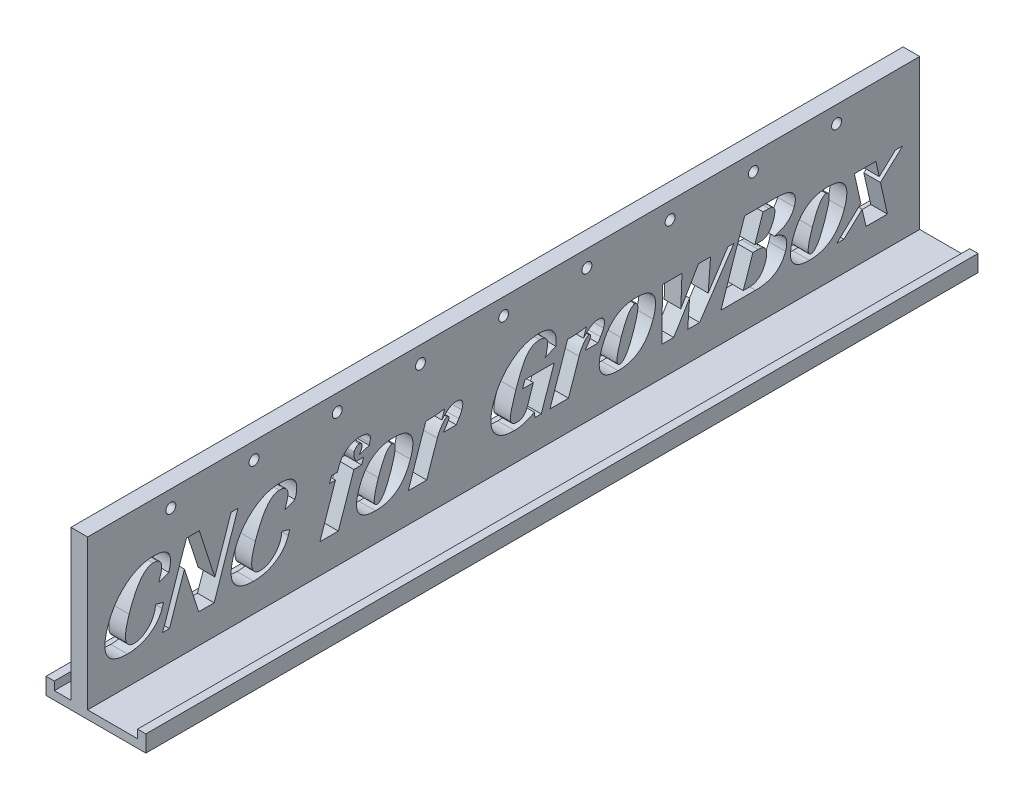
from build123d import *

# Parameters (mm, degrees)
BOSS_EXTRUDE1_DEPTH = 500
SKETCH4_R           = 3
CUT_EXTRUDE3_DEPTH  = 10
LPATTERN2_COUNT     = 9
LPATTERN2_PITCH     = 50
CUT_EXTRUDE4_DEPTH  = 10


with BuildPart() as part:
    # Sketch1 → Boss-Extrude1 (new body)
    with BuildSketch(Plane.XY):
        Polygon((0, 10), (0, 0), (60, 0), (60, 10), (55, 10), (55, 5), (25, 5), (25, 95), (15, 95), (15, 5), (5, 5), (5, 10), align=None)
    extrude(amount=BOSS_EXTRUDE1_DEPTH)

    # Sketch4 → Cut-Extrude3 (cut)
    with BuildSketch(Plane(origin=(25, 0, 0), x_dir=(0, 0, -1), z_dir=(1, 0, 0))):
        with Locations((-450, 85)):
            Circle(SKETCH4_R)
    cut_extrude3 = extrude(amount=-CUT_EXTRUDE3_DEPTH, mode=Mode.SUBTRACT)

    # LPattern2: Cut-Extrude3 ×9
    with Locations(*[(0, 0, -i * LPATTERN2_PITCH) for i in range(1, LPATTERN2_COUNT)]):
        add(cut_extrude3, mode=Mode.SUBTRACT)

    # Sketch5 → Cut-Extrude4 (cut)
    # profile 1 of 13: a face of its own
    with BuildSketch(Plane(origin=(25, 0, 0), x_dir=(0, 0, -1), z_dir=(1, 0, 0))):
        with BuildLine():
            Line((-459.161110895, 39.51730532), (-454.421527562, 38.159232404))
            add(Edge.make_bspline(
                [(-454.421527562, 38.159232404), (-454.557358156, 37.665866309), (-454.810785543, 36.745363235), (-455.105216544, 35.837168443), (-455.241840062, 35.41574282)],
                knots=[0, 0, 0, 0, 1.071948824, 2, 2, 2, 2], degree=3))
            add(Edge.make_bspline(
                [(-455.241840062, 35.41574282), (-455.42420157, 34.919729406), (-455.785331039, 33.93747683), (-456.483717378, 32.537469266), (-457.26685806, 31.201074568), (-458.194099839, 29.958302794), (-459.210962327, 28.775209094), (-460.359418633, 27.682164967), (-461.612016317, 26.658933351), (-462.963455446, 25.715054219), (-464.402513774, 24.869424028), (-465.904311837, 24.1313331), (-467.464954886, 23.508611183), (-469.078717264, 22.996548219), (-470.752653154, 22.606694765), (-472.479164194, 22.326209691), (-474.260127081, 22.145492745), (-475.466660783, 22.126955145), (-476.077777562, 22.117565737)],
                knots=[0, 0, 0, 0, 0.959608273, 1.900306866, 2.838588561, 3.770530829, 4.713672441, 5.67029048, 6.647211372, 7.650361338, 8.662524894, 9.677289817, 10.688112489, 11.713023596, 12.75083405, 13.808195716, 14.88983758, 16, 16, 16, 16], degree=3))
            add(Edge.make_bspline(
                [(-476.077777562, 22.117565737), (-476.822843901, 22.131935055), (-478.25056488, 22.159470021), (-480.293023972, 22.40466536), (-482.135299547, 22.810906875), (-483.78698429, 23.367542536), (-485.235288516, 24.109717295), (-486.481859838, 25.016805255), (-487.527859758, 26.092050507), (-488.350216837, 27.343304949), (-488.990113947, 28.746021332), (-489.402122483, 30.317762367), (-489.61509731, 32.045631602), (-489.624342171, 33.934374484), (-489.43278083, 35.983460499), (-489.043410082, 38.195320243), (-488.443738018, 40.567464255), (-487.923906627, 42.18459262), (-487.653298395, 43.026419904)],
                knots=[0, 0, 0, 0, 1.188371361, 2.277196852, 3.275607737, 4.193834061, 5.050162067, 5.861634596, 6.643226294, 7.429687769, 8.238826122, 9.092488531, 10.011162535, 11.009738138, 12.099836037, 13.290399986, 14.58946558, 16, 16, 16, 16], degree=3))
            add(Edge.make_bspline(
                [(-487.653298395, 43.026419904), (-487.360773926, 43.839091562), (-486.783537623, 45.442730342), (-485.730366705, 47.745947975), (-484.5696536, 49.941612959), (-483.259456087, 52.00971765), (-481.835399629, 53.975902299), (-480.26692908, 55.811468748), (-478.571379983, 57.536525696), (-476.760197845, 59.127172484), (-474.871136638, 60.573415012), (-472.919019684, 61.824214914), (-470.939385114, 62.903629651), (-468.910046915, 63.767015891), (-466.8471071, 64.450019633), (-464.748264638, 64.933155623), (-462.608449529, 65.222899541), (-461.17023672, 65.26369615), (-460.446267145, 65.284232404)],
                knots=[0, 0, 0, 0, 1.10590169, 2.182267365, 3.240784825, 4.284853365, 5.315446473, 6.347918835, 7.374366952, 8.411142825, 9.433103175, 10.418671707, 11.378077474, 12.317794117, 13.239546828, 14.158073567, 15.072808497, 16, 16, 16, 16], degree=3))
            add(Edge.make_bspline(
                [(-460.446267145, 65.284232404), (-459.902204346, 65.272490358), (-458.857585084, 65.249945228), (-457.355450336, 65.114033425), (-455.999393291, 64.847761749), (-454.776483312, 64.497325518), (-453.700421866, 64.036050113), (-452.758385154, 63.473137675), (-451.953186777, 62.806304391), (-451.3018065, 62.0212929), (-450.786120222, 61.139288103), (-450.439276259, 60.147930309), (-450.202630012, 59.064434663), (-450.147631926, 57.874140371), (-450.195842913, 56.584617813), (-450.421476631, 55.195884038), (-450.766255253, 53.705828634), (-451.09010804, 52.694852608), (-451.258767145, 52.168346987)],
                knots=[0, 0, 0, 0, 1.289754129, 2.476372226, 3.569498017, 4.56068904, 5.486411475, 6.336102184, 7.153947633, 7.951504273, 8.742007375, 9.56213236, 10.430745964, 11.3614965, 12.377796713, 13.484852439, 14.690137755, 16, 16, 16, 16], degree=3))
            Line((-451.258767145, 52.168346987), (-457.301735895, 49.780326154))
            add(Edge.make_bspline(
                [(-457.301735895, 49.780326154), (-457.214545183, 50.066205058), (-457.049150435, 50.608497556), (-456.803748985, 51.363318087), (-456.592096396, 52.019897661), (-456.460324577, 52.420571794), (-456.399392145, 52.605846987)],
                knots=[0, 0, 0, 0, 1.209122552, 2.293621811, 3.210955934, 4, 4, 4, 4], degree=3))
            add(Edge.make_bspline(
                [(-456.399392145, 52.605846987), (-456.280924626, 52.975564138), (-456.053167792, 53.68635481), (-455.773531946, 54.724294312), (-455.590111047, 55.696453897), (-455.485282334, 56.59543531), (-455.468113498, 57.424993803), (-455.511700903, 58.181917938), (-455.660416846, 58.869127392), (-455.888518839, 59.482373262), (-456.188435206, 60.035327969), (-456.591971537, 60.504139766), (-457.065758258, 60.909704826), (-457.630610425, 61.231270692), (-458.270104769, 61.489153615), (-458.996814914, 61.651775794), (-459.798480202, 61.767441206), (-460.360710968, 61.778451565), (-460.655902562, 61.784232404)],
                knots=[0, 0, 0, 0, 1.473995899, 2.833794789, 4.078113512, 5.227138281, 6.265573707, 7.225503937, 8.098842969, 8.923759755, 9.703568102, 10.473070159, 11.258828084, 12.060097264, 12.92977192, 13.867048012, 14.880122655, 16, 16, 16, 16], degree=3))
            add(Edge.make_bspline(
                [(-460.655902562, 61.784232404), (-460.979208186, 61.770409686), (-461.633747642, 61.742425285), (-462.605901063, 61.503781059), (-463.562514623, 61.11290844), (-464.510016263, 60.574685918), (-465.450229257, 59.888528421), (-466.368980947, 59.038944471), (-467.28461753, 58.049568897), (-468.183750945, 56.900872774), (-469.087694809, 55.608468111), (-469.965382156, 54.153488815), (-470.840426718, 52.556713766), (-471.706542955, 50.806807837), (-472.570362045, 48.908376059), (-473.415546481, 46.851066055), (-474.254011803, 44.647410054), (-474.784425544, 43.118990688), (-475.056944228, 42.33371157)],
                knots=[0, 0, 0, 0, 0.608730714, 1.232388927, 1.874671758, 2.551581591, 3.281205007, 4.063553032, 4.906412784, 5.819526811, 6.810799485, 7.877366486, 9.020379324, 10.241954853, 11.55662264, 12.950800273, 14.433366571, 16, 16, 16, 16], degree=3))
            add(Edge.make_bspline(
                [(-475.056944228, 42.33371157), (-475.280985814, 41.660896302), (-475.712578722, 40.364787378), (-476.249726593, 38.47000022), (-476.672842051, 36.706287931), (-476.986078883, 35.07334493), (-477.193723319, 33.567736442), (-477.281302606, 32.190301951), (-477.249458186, 30.944945275), (-477.106511226, 29.829032534), (-476.860803539, 28.836845204), (-476.484423799, 27.972079924), (-475.989930464, 27.237929685), (-475.37051357, 26.644217917), (-474.650761636, 26.163464501), (-473.797013454, 25.854625256), (-472.843087523, 25.6460955), (-472.165851087, 25.627353876), (-471.812152562, 25.617565737)],
                knots=[0, 0, 0, 0, 1.681988387, 3.240176405, 4.670082134, 5.983193915, 7.182866418, 8.273049076, 9.253619859, 10.133253211, 10.93733841, 11.669829657, 12.359479887, 13.022050276, 13.693691261, 14.396360891, 15.162471542, 16, 16, 16, 16], degree=3))
            add(Edge.make_bspline(
                [(-471.812152562, 25.617565737), (-471.504926384, 25.62718288), (-470.8939335, 25.646308874), (-469.979317622, 25.774858819), (-469.078570581, 26.008277768), (-468.184244535, 26.316704392), (-467.300500764, 26.714557209), (-466.425117403, 27.198353849), (-465.557615245, 27.775934784), (-464.710027666, 28.436659136), (-463.895474878, 29.162553832), (-463.12684463, 29.93246323), (-462.433604488, 30.76127608), (-461.794689347, 31.624147618), (-461.219187412, 32.533443346), (-460.695452085, 33.478899396), (-460.249153682, 34.478817082), (-459.998557534, 35.168053918), (-459.872048395, 35.516003237)],
                knots=[0, 0, 0, 0, 0.894992687, 1.779907445, 2.683609881, 3.601673395, 4.532657576, 5.503187957, 6.512064498, 7.56541979, 8.631158139, 9.688817706, 10.731372136, 11.775765717, 12.81433043, 13.863960975, 14.921657571, 16, 16, 16, 16], degree=3))
            add(Edge.make_bspline(
                [(-459.872048395, 35.516003237), (-459.795078727, 35.767126343), (-459.626208883, 36.318085185), (-459.445809807, 37.243572602), (-459.282028524, 38.326139769), (-459.203101734, 39.103651484), (-459.161110895, 39.51730532)],
                knots=[0, 0, 0, 0, 0.77360874, 1.6972814, 2.77490157, 4, 4, 4, 4], degree=3))
        make_face()
    # profile 2 of 13: a face of its own
    with BuildSketch(Plane(origin=(25, 0, 0), x_dir=(0, 0, -1), z_dir=(1, 0, 0))):
        Polygon((-409.705381728, 64.70089907), (-423.978819228, 22.70089907), (-433.284808812, 22.70089907), (-441.806944228, 49.19699282), (-450.812152562, 22.70089907), (-454.895485895, 22.70089907), (-440.622048395, 64.70089907), (-432.911110895, 64.70089907), (-423.559548395, 35.953503237), (-413.788715062, 64.70089907), align=None)
    # profile 3 of 13: a face of its own
    with BuildSketch(Plane(origin=(25, 0, 0), x_dir=(0, 0, -1), z_dir=(1, 0, 0))):
        with BuildLine():
            Line((-383.327777562, 39.51730532), (-378.588194228, 38.159232404))
            add(Edge.make_bspline(
                [(-378.588194228, 38.159232404), (-378.724024823, 37.665866309), (-378.97745221, 36.745363235), (-379.27188321, 35.837168443), (-379.408506728, 35.41574282)],
                knots=[0, 0, 0, 0, 1.071948824, 2, 2, 2, 2], degree=3))
            add(Edge.make_bspline(
                [(-379.408506728, 35.41574282), (-379.590868237, 34.919729406), (-379.951997706, 33.93747683), (-380.650384045, 32.537469266), (-381.433524727, 31.201074568), (-382.360766505, 29.958302794), (-383.377628993, 28.775209094), (-384.5260853, 27.682164967), (-385.778682984, 26.658933351), (-387.130122113, 25.715054219), (-388.569180441, 24.869424028), (-390.070978504, 24.1313331), (-391.631621553, 23.508611183), (-393.245383931, 22.996548219), (-394.919319821, 22.606694765), (-396.645830861, 22.326209691), (-398.426793748, 22.145492745), (-399.633327449, 22.126955145), (-400.244444228, 22.117565737)],
                knots=[0, 0, 0, 0, 0.959608273, 1.900306866, 2.838588561, 3.770530829, 4.713672441, 5.67029048, 6.647211372, 7.650361338, 8.662524894, 9.677289817, 10.688112489, 11.713023596, 12.75083405, 13.808195716, 14.88983758, 16, 16, 16, 16], degree=3))
            add(Edge.make_bspline(
                [(-400.244444228, 22.117565737), (-400.989510568, 22.131935055), (-402.417231547, 22.159470021), (-404.459690638, 22.40466536), (-406.301966213, 22.810906875), (-407.953650957, 23.367542536), (-409.401955182, 24.109717295), (-410.648526505, 25.016805255), (-411.694526425, 26.092050507), (-412.516883504, 27.343304949), (-413.156780614, 28.746021332), (-413.56878915, 30.317762367), (-413.781763977, 32.045631602), (-413.791008838, 33.934374484), (-413.599447496, 35.983460499), (-413.210076749, 38.195320243), (-412.610404685, 40.567464255), (-412.090573294, 42.18459262), (-411.819965062, 43.026419904)],
                knots=[0, 0, 0, 0, 1.188371361, 2.277196852, 3.275607737, 4.193834061, 5.050162067, 5.861634596, 6.643226294, 7.429687769, 8.238826122, 9.092488531, 10.011162535, 11.009738138, 12.099836037, 13.290399986, 14.58946558, 16, 16, 16, 16], degree=3))
            add(Edge.make_bspline(
                [(-411.819965062, 43.026419904), (-411.527440592, 43.839091562), (-410.950204289, 45.442730342), (-409.897033372, 47.745947975), (-408.736320266, 49.941612959), (-407.426122753, 52.00971765), (-406.002066296, 53.975902299), (-404.433595747, 55.811468748), (-402.73804665, 57.536525696), (-400.926864511, 59.127172484), (-399.037803305, 60.573415012), (-397.08568635, 61.824214914), (-395.106051781, 62.903629651), (-393.076713582, 63.767015891), (-391.013773766, 64.450019633), (-388.914931305, 64.933155623), (-386.775116196, 65.222899541), (-385.336903387, 65.26369615), (-384.612933812, 65.284232404)],
                knots=[0, 0, 0, 0, 1.10590169, 2.182267365, 3.240784825, 4.284853365, 5.315446473, 6.347918835, 7.374366952, 8.411142825, 9.433103175, 10.418671707, 11.378077474, 12.317794117, 13.239546828, 14.158073567, 15.072808497, 16, 16, 16, 16], degree=3))
            add(Edge.make_bspline(
                [(-384.612933812, 65.284232404), (-384.068871012, 65.272490358), (-383.024251751, 65.249945228), (-381.522117003, 65.114033425), (-380.166059958, 64.847761749), (-378.943149979, 64.497325518), (-377.867088532, 64.036050113), (-376.925051821, 63.473137675), (-376.119853444, 62.806304391), (-375.468473167, 62.0212929), (-374.952786888, 61.139288103), (-374.605942925, 60.147930309), (-374.369296679, 59.064434663), (-374.314298593, 57.874140371), (-374.36250958, 56.584617813), (-374.588143297, 55.195884038), (-374.93292192, 53.705828634), (-375.256774706, 52.694852608), (-375.425433812, 52.168346987)],
                knots=[0, 0, 0, 0, 1.289754129, 2.476372226, 3.569498017, 4.56068904, 5.486411475, 6.336102184, 7.153947633, 7.951504273, 8.742007375, 9.56213236, 10.430745964, 11.3614965, 12.377796713, 13.484852439, 14.690137755, 16, 16, 16, 16], degree=3))
            Line((-375.425433812, 52.168346987), (-381.468402562, 49.780326154))
            add(Edge.make_bspline(
                [(-381.468402562, 49.780326154), (-381.381211849, 50.066205058), (-381.215817102, 50.608497556), (-380.970415652, 51.363318087), (-380.758763063, 52.019897661), (-380.626991243, 52.420571794), (-380.566058812, 52.605846987)],
                knots=[0, 0, 0, 0, 1.209122552, 2.293621811, 3.210955934, 4, 4, 4, 4], degree=3))
            add(Edge.make_bspline(
                [(-380.566058812, 52.605846987), (-380.447591292, 52.975564138), (-380.219834458, 53.68635481), (-379.940198612, 54.724294312), (-379.756777713, 55.696453897), (-379.651949, 56.59543531), (-379.634780164, 57.424993803), (-379.678367569, 58.181917938), (-379.827083512, 58.869127392), (-380.055185505, 59.482373262), (-380.355101872, 60.035327969), (-380.758638204, 60.504139766), (-381.232424925, 60.909704826), (-381.797277092, 61.231270692), (-382.436771435, 61.489153615), (-383.163481581, 61.651775794), (-383.965146869, 61.767441206), (-384.527377635, 61.778451565), (-384.822569228, 61.784232404)],
                knots=[0, 0, 0, 0, 1.473995899, 2.833794789, 4.078113512, 5.227138281, 6.265573707, 7.225503937, 8.098842969, 8.923759755, 9.703568102, 10.473070159, 11.258828084, 12.060097264, 12.92977192, 13.867048012, 14.880122655, 16, 16, 16, 16], degree=3))
            add(Edge.make_bspline(
                [(-384.822569228, 61.784232404), (-385.145874852, 61.770409686), (-385.800414309, 61.742425285), (-386.77256773, 61.503781059), (-387.72918129, 61.11290844), (-388.67668293, 60.574685918), (-389.616895924, 59.888528421), (-390.535647614, 59.038944471), (-391.451284197, 58.049568897), (-392.350417612, 56.900872774), (-393.254361476, 55.608468111), (-394.132048822, 54.153488815), (-395.007093385, 52.556713766), (-395.873209622, 50.806807837), (-396.737028712, 48.908376059), (-397.582213147, 46.851066055), (-398.42067847, 44.647410054), (-398.951092211, 43.118990688), (-399.223610895, 42.33371157)],
                knots=[0, 0, 0, 0, 0.608730714, 1.232388927, 1.874671758, 2.551581591, 3.281205007, 4.063553032, 4.906412784, 5.819526811, 6.810799485, 7.877366486, 9.020379324, 10.241954853, 11.55662264, 12.950800273, 14.433366571, 16, 16, 16, 16], degree=3))
            add(Edge.make_bspline(
                [(-399.223610895, 42.33371157), (-399.447652481, 41.660896302), (-399.879245388, 40.364787378), (-400.416393259, 38.47000022), (-400.839508717, 36.706287931), (-401.15274555, 35.07334493), (-401.360389986, 33.567736442), (-401.447969273, 32.190301951), (-401.416124852, 30.944945275), (-401.273177892, 29.829032534), (-401.027470205, 28.836845204), (-400.651090466, 27.972079924), (-400.15659713, 27.237929685), (-399.537180237, 26.644217917), (-398.817428302, 26.163464501), (-397.963680121, 25.854625256), (-397.009754189, 25.6460955), (-396.332517754, 25.627353876), (-395.978819228, 25.617565737)],
                knots=[0, 0, 0, 0, 1.681988387, 3.240176405, 4.670082134, 5.983193915, 7.182866418, 8.273049076, 9.253619859, 10.133253211, 10.93733841, 11.669829657, 12.359479887, 13.022050276, 13.693691261, 14.396360891, 15.162471542, 16, 16, 16, 16], degree=3))
            add(Edge.make_bspline(
                [(-395.978819228, 25.617565737), (-395.67159305, 25.62718288), (-395.060600167, 25.646308874), (-394.145984289, 25.774858819), (-393.245237248, 26.008277768), (-392.350911202, 26.316704392), (-391.46716743, 26.714557209), (-390.591784069, 27.198353849), (-389.724281912, 27.775934784), (-388.876694333, 28.436659136), (-388.062141544, 29.162553832), (-387.293511296, 29.93246323), (-386.600271154, 30.76127608), (-385.961356013, 31.624147618), (-385.385854079, 32.533443346), (-384.862118752, 33.478899396), (-384.415820348, 34.478817082), (-384.165224201, 35.168053918), (-384.038715062, 35.516003237)],
                knots=[0, 0, 0, 0, 0.894992687, 1.779907445, 2.683609881, 3.601673395, 4.532657576, 5.503187957, 6.512064498, 7.56541979, 8.631158139, 9.688817706, 10.731372136, 11.775765717, 12.81433043, 13.863960975, 14.921657571, 16, 16, 16, 16], degree=3))
            add(Edge.make_bspline(
                [(-384.038715062, 35.516003237), (-383.961745393, 35.767126343), (-383.79287555, 36.318085185), (-383.612476473, 37.243572602), (-383.448695191, 38.326139769), (-383.369768401, 39.103651484), (-383.327777562, 39.51730532)],
                knots=[0, 0, 0, 0, 0.77360874, 1.6972814, 2.77490157, 4, 4, 4, 4], degree=3))
        make_face()
    # profile 4 of 13: a face of its own
    with BuildSketch(Plane(origin=(25, 0, 0), x_dir=(0, 0, -1), z_dir=(1, 0, 0))):
        with BuildLine():
            Line((-334.136371312, 53.617565737), (-335.330381728, 50.117565737))
            Line((-335.330381728, 50.117565737), (-339.997048395, 50.117565737))
            Line((-339.997048395, 50.117565737), (-349.312152562, 22.70089907))
            Line((-349.312152562, 22.70089907), (-360.395485895, 22.70089907))
            Line((-360.395485895, 22.70089907), (-351.080381728, 50.117565737))
            Line((-351.080381728, 50.117565737), (-354.580381728, 50.117565737))
            Line((-354.580381728, 50.117565737), (-353.386371312, 53.617565737))
            Line((-353.386371312, 53.617565737), (-349.886371312, 53.617565737))
            Line((-349.886371312, 53.617565737), (-348.938454645, 56.41574282))
            add(Edge.make_bspline(
                [(-348.938454645, 56.41574282), (-348.825491734, 56.730904307), (-348.601051745, 57.357081872), (-348.168025036, 58.253036296), (-347.660016382, 59.106165841), (-347.092728077, 59.924356359), (-346.442334431, 60.692304608), (-345.744887934, 61.438523618), (-344.957366485, 62.125839574), (-344.112764094, 62.769443022), (-343.229816512, 63.359743628), (-342.315049947, 63.867071953), (-341.390854914, 64.313441621), (-340.444028808, 64.666341967), (-339.483041131, 64.939176193), (-338.509346155, 65.144124539), (-337.517931251, 65.2648232), (-336.849799582, 65.277756782), (-336.515277562, 65.284232404)],
                knots=[0, 0, 0, 0, 0.988868094, 1.964729329, 2.934832242, 3.921210766, 4.902960783, 5.90639564, 6.936862016, 7.987394989, 9.043247732, 10.072304976, 11.076342196, 12.073612177, 13.054088607, 14.026100929, 15.011702728, 16, 16, 16, 16], degree=3))
            add(Edge.make_bspline(
                [(-336.515277562, 65.284232404), (-336.190180774, 65.277244857), (-335.566690442, 65.263843718), (-334.669733434, 65.210789949), (-333.858410517, 65.076578349), (-333.122834661, 64.916453358), (-332.462908073, 64.711840529), (-331.884376524, 64.447158708), (-331.38534068, 64.133979663), (-330.956431179, 63.779052501), (-330.618378801, 63.364503908), (-330.356344918, 62.90590956), (-330.170022096, 62.40174142), (-330.085238588, 61.842111474), (-330.069381689, 61.242545252), (-330.123462959, 60.593004863), (-330.276085953, 59.901846773), (-330.42307116, 59.431587818), (-330.499652562, 59.186576154)],
                knots=[0, 0, 0, 0, 1.452743398, 2.786159375, 4.008894179, 5.121774221, 6.147583477, 7.088837921, 7.954878788, 8.77335517, 9.564016358, 10.329946604, 11.12421044, 11.949745199, 12.845889084, 13.799392113, 14.853451713, 16, 16, 16, 16], degree=3))
            add(Edge.make_bspline(
                [(-330.499652562, 59.186576154), (-330.551917165, 59.014244405), (-330.667902757, 58.631805839), (-330.729909677, 58.236877839), (-330.763975478, 58.019909487)],
                knots=[0, 0, 0, 0, 0.901225785, 2, 2, 2, 2], degree=3))
            Line((-330.763975478, 58.019909487), (-336.916319228, 56.124076154))
            add(Edge.make_bspline(
                [(-336.916319228, 56.124076154), (-336.724288252, 56.367553581), (-336.36674127, 56.820889918), (-335.925244294, 57.485027996), (-335.580218629, 58.057009288), (-335.432774057, 58.428158437), (-335.366840062, 58.594128237)],
                knots=[0, 0, 0, 0, 1.270377698, 2.365346047, 3.269018423, 4, 4, 4, 4], degree=3))
            add(Edge.make_bspline(
                [(-335.366840062, 58.594128237), (-335.286975924, 58.841407083), (-335.139953536, 59.296624252), (-335.034420815, 59.951544319), (-335.035101556, 60.51138051), (-335.142365003, 60.986112734), (-335.395041036, 61.358387232), (-335.76654703, 61.610952406), (-336.241706851, 61.770643971), (-336.595810519, 61.779440391), (-336.788715062, 61.784232404)],
                knots=[0, 0, 0, 0, 1.431079141, 2.634482506, 3.639592941, 4.504912477, 5.276118037, 6.056904157, 6.941462491, 8, 8, 8, 8], degree=3))
            add(Edge.make_bspline(
                [(-336.788715062, 61.784232404), (-336.962518362, 61.774851909), (-337.302831892, 61.756484542), (-337.799497461, 61.629455067), (-338.245888786, 61.391239691), (-338.670225889, 61.087828227), (-339.040863168, 60.68040806), (-339.369341857, 60.185115504), (-339.674938752, 59.611074959), (-339.826523316, 59.18292035), (-339.905902562, 58.95871157)],
                knots=[0, 0, 0, 0, 0.922204368, 1.805711532, 2.692300451, 3.59168856, 4.560997217, 5.593626456, 6.739870916, 8, 8, 8, 8], degree=3))
            add(Edge.make_bspline(
                [(-339.905902562, 58.95871157), (-339.946764536, 58.804654107), (-340.032252464, 58.482348258), (-340.075849288, 57.955995797), (-340.029170368, 57.375754003), (-339.929293858, 56.734924149), (-339.75334606, 56.034193445), (-339.501754836, 55.279139973), (-339.193768591, 54.460352314), (-338.937507298, 53.907609399), (-338.803037978, 53.617565737)],
                knots=[0, 0, 0, 0, 0.68638462, 1.435995198, 2.263004761, 3.19131145, 4.230326149, 5.373775291, 6.621927463, 8, 8, 8, 8], degree=3))
            Line((-338.803037978, 53.617565737), (-334.136371312, 53.617565737))
        make_face()
    # profile 5 of 13: a face of its own
    with BuildSketch(Plane(origin=(25, 0, 0), x_dir=(0, 0, -1), z_dir=(1, 0, 0))):
        with BuildLine():
            add(Edge.make_bspline(
                [(-315.934548395, 54.784232404), (-315.317272191, 54.773037496), (-314.134177263, 54.751580914), (-312.443794455, 54.56139851), (-310.916025972, 54.246198522), (-309.548374646, 53.804525964), (-308.340383982, 53.229880882), (-307.294004578, 52.527134514), (-306.422675964, 51.680993499), (-305.709845145, 50.712634105), (-305.168270703, 49.610404094), (-304.795388513, 48.382319469), (-304.591594013, 47.029387711), (-304.549161516, 45.551659119), (-304.690414349, 43.95060682), (-304.976392976, 42.223138833), (-305.425849965, 40.36830303), (-305.833075643, 39.107652405), (-306.045225478, 38.45089907)],
                knots=[0, 0, 0, 0, 1.229247068, 2.356021443, 3.382708377, 4.331935857, 5.211636368, 6.039164321, 6.8309341, 7.618924968, 8.422745332, 9.265012565, 10.165451544, 11.140262277, 12.202712173, 13.361787333, 14.625586715, 16, 16, 16, 16], degree=3))
            add(Edge.make_bspline(
                [(-306.045225478, 38.45089907), (-306.280113385, 37.788479052), (-306.740114925, 36.491203967), (-307.554485567, 34.637125128), (-308.450798783, 32.915435618), (-309.402237036, 31.305658545), (-310.457020841, 29.843075699), (-311.567236773, 28.48676639), (-312.775382372, 27.279507548), (-314.046010813, 26.183025914), (-315.401378289, 25.222424138), (-316.836483365, 24.392184218), (-318.348548465, 23.685588694), (-319.938736325, 23.112711947), (-321.60352079, 22.665325734), (-323.344003619, 22.348171334), (-325.163123674, 22.15236078), (-326.403665182, 22.12931487), (-327.036110895, 22.117565737)],
                knots=[0, 0, 0, 0, 1.175065552, 2.301233694, 3.382913599, 4.419814754, 5.425063526, 6.395650903, 7.347709817, 8.277394233, 9.199369194, 10.121358154, 11.046477625, 11.986695364, 12.944323502, 13.925912684, 14.942600774, 16, 16, 16, 16], degree=3))
            add(Edge.make_bspline(
                [(-327.036110895, 22.117565737), (-327.653422188, 22.128596127), (-328.83658437, 22.149737389), (-330.532426633, 22.342743758), (-332.067445384, 22.652692726), (-333.440311513, 23.097674702), (-334.649027965, 23.671324678), (-335.694946863, 24.377739683), (-336.575523506, 25.217467922), (-337.287739407, 26.189589602), (-337.829890199, 27.291276224), (-338.202410283, 28.519501054), (-338.407126618, 29.872454389), (-338.445845244, 31.349677532), (-338.320347261, 32.951705221), (-338.029606842, 34.678573337), (-337.581586741, 36.533519651), (-337.174151273, 37.794154141), (-336.961892145, 38.45089907)],
                knots=[0, 0, 0, 0, 1.228038986, 2.353705987, 3.391218502, 4.339513098, 5.218349054, 6.045063728, 6.840410309, 7.627626754, 8.430657137, 9.272096605, 10.171650648, 11.145503354, 12.206444081, 13.364380122, 14.626937465, 16, 16, 16, 16], degree=3))
            add(Edge.make_bspline(
                [(-336.961892145, 38.45089907), (-336.727090827, 39.113374511), (-336.267258861, 40.410758136), (-335.451672934, 42.264059106), (-334.558980984, 43.98992216), (-333.592213332, 45.589670039), (-332.553176353, 47.065805887), (-331.428841521, 48.407872844), (-330.231958052, 49.628760926), (-328.951018127, 50.718319022), (-327.58905684, 51.677094904), (-326.152578095, 52.509930843), (-324.640250772, 53.215975221), (-323.047573895, 53.790713826), (-321.376090779, 54.236281526), (-319.629576619, 54.5528857), (-317.807549916, 54.749548882), (-316.566998936, 54.772520928), (-315.934548395, 54.784232404)],
                knots=[0, 0, 0, 0, 1.17379807, 2.298751473, 3.379264627, 4.417667667, 5.418890693, 6.391680266, 7.339143885, 8.271686748, 9.196811248, 10.117805706, 11.0419273, 11.981130875, 12.942627758, 13.928149894, 14.943741336, 16, 16, 16, 16], degree=3))
        make_face()
        with BuildLine():
            add(Edge.make_bspline(
                [(-316.955381728, 51.867565737), (-317.114427901, 51.855616834), (-317.442591611, 51.830962381), (-317.933209813, 51.667437754), (-318.419423748, 51.392494993), (-318.916586435, 51.023048336), (-319.413519634, 50.542282652), (-319.927618169, 49.967281967), (-320.431616262, 49.276875324), (-320.95544456, 48.493160533), (-321.468281942, 47.595735488), (-321.999948539, 46.600110957), (-322.532686007, 45.497140879), (-323.083603358, 44.293570847), (-323.624492921, 42.97974751), (-324.182241622, 41.564430564), (-324.747426734, 40.046059887), (-325.109220993, 38.992534243), (-325.295225478, 38.45089907)],
                knots=[0, 0, 0, 0, 0.465798473, 0.96109295, 1.498705268, 2.096703288, 2.770241422, 3.520316646, 4.353229604, 5.271341494, 6.280187857, 7.378906499, 8.576821054, 9.867090618, 11.255275713, 12.73753087, 14.322709995, 16, 16, 16, 16], degree=3))
            add(Edge.make_bspline(
                [(-325.295225478, 38.45089907), (-325.476284247, 37.910701003), (-325.826221874, 36.866644251), (-326.302504574, 35.348715664), (-326.700530552, 33.929985585), (-327.05252019, 32.623192808), (-327.328040031, 31.415787911), (-327.533155605, 30.314184748), (-327.702925563, 29.319667115), (-327.769325106, 28.425885176), (-327.794056311, 27.637884863), (-327.758642415, 26.951281019), (-327.63660625, 26.370875576), (-327.475325617, 25.883050844), (-327.22140235, 25.504185527), (-326.903441071, 25.22532489), (-326.508819492, 25.063684425), (-326.226374898, 25.044327215), (-326.079079645, 25.034232404)],
                knots=[0, 0, 0, 0, 1.867939927, 3.610222641, 5.215197755, 6.698700538, 8.047097408, 9.273972599, 10.372859214, 11.352294881, 12.209181684, 12.957923034, 13.598694019, 14.150165215, 14.630885378, 15.076025384, 15.51814594, 16, 16, 16, 16], degree=3))
            add(Edge.make_bspline(
                [(-326.079079645, 25.034232404), (-325.916899556, 25.045810687), (-325.585481769, 25.069471109), (-325.090315546, 25.236613556), (-324.598180374, 25.506243283), (-324.099868103, 25.879196728), (-323.602748557, 26.359444614), (-323.088137249, 26.934230395), (-322.585802178, 27.627723085), (-322.049454153, 28.40519363), (-321.541106761, 29.309026563), (-320.996201183, 30.298979623), (-320.464231094, 31.402887204), (-319.925777625, 32.610590039), (-319.381812401, 33.921692326), (-318.825115427, 35.337473186), (-318.259625191, 36.855709275), (-317.897874323, 37.909254057), (-317.711892145, 38.45089907)],
                knots=[0, 0, 0, 0, 0.47398303, 0.968592427, 1.513273463, 2.110444346, 2.783050859, 3.532088596, 4.363849489, 5.285630575, 6.293081526, 7.394482706, 8.590740334, 9.875573513, 11.261838504, 12.74204344, 14.325029983, 16, 16, 16, 16], degree=3))
            add(Edge.make_bspline(
                [(-317.711892145, 38.45089907), (-317.5304277, 38.99098139), (-317.179706011, 40.034814434), (-316.708609709, 41.555094472), (-316.292239799, 42.968666624), (-315.95594665, 44.279933629), (-315.684393672, 45.48744251), (-315.45396727, 46.584452969), (-315.32272272, 47.584614656), (-315.235362712, 48.474993794), (-315.208530594, 49.264850985), (-315.264786406, 49.948481999), (-315.365060342, 50.533830066), (-315.541628868, 51.020140483), (-315.80402046, 51.395235946), (-316.12155102, 51.676778818), (-316.519486661, 51.839216711), (-316.805026138, 51.857787157), (-316.955381728, 51.867565737)],
                knots=[0, 0, 0, 0, 1.865850032, 3.606183439, 5.212108544, 6.691444057, 8.03833231, 9.265731815, 10.360498967, 11.339698587, 12.195626685, 12.944258019, 13.5823757, 14.136723438, 14.622542498, 15.06718447, 15.508810371, 16, 16, 16, 16], degree=3))
        make_face(mode=Mode.SUBTRACT)
    # profile 6 of 13: a face of its own
    with BuildSketch(Plane(origin=(25, 0, 0), x_dir=(0, 0, -1), z_dir=(1, 0, 0))):
        with BuildLine():
            Line((-278.473610895, 42.534232404), (-286.157204645, 42.534232404))
            add(Edge.make_bspline(
                [(-286.157204645, 42.534232404), (-285.98517243, 42.820533276), (-285.663350637, 43.356118195), (-285.199388209, 44.090089598), (-284.79837936, 44.711301352), (-284.536131023, 45.075070614), (-284.416319228, 45.241263654)],
                knots=[0, 0, 0, 0, 1.244874051, 2.328794053, 3.236486356, 4, 4, 4, 4], degree=3))
            add(Edge.make_bspline(
                [(-284.416319228, 45.241263654), (-284.267879352, 45.446071054), (-283.983328041, 45.838675897), (-283.616373663, 46.430148258), (-283.330119228, 46.995100405), (-283.18893122, 47.369767806), (-283.122048395, 47.547253237)],
                knots=[0, 0, 0, 0, 1.143064377, 2.191193324, 3.143141809, 4, 4, 4, 4], degree=3))
            add(Edge.make_bspline(
                [(-283.122048395, 47.547253237), (-283.073491197, 47.701264185), (-282.984084894, 47.984837989), (-282.90210453, 48.391731353), (-282.901047173, 48.740667683), (-282.953827566, 49.036395209), (-283.103392921, 49.262858101), (-283.315712138, 49.422306486), (-283.593055032, 49.528507422), (-283.801471557, 49.532213388), (-283.915017145, 49.534232404)],
                knots=[0, 0, 0, 0, 1.461138339, 2.69033184, 3.734784726, 4.60829083, 5.363019644, 6.127198478, 6.979695349, 8, 8, 8, 8], degree=3))
            add(Edge.make_bspline(
                [(-283.915017145, 49.534232404), (-284.013503177, 49.527437874), (-284.227110331, 49.512701165), (-284.545780173, 49.365624769), (-284.899066618, 49.166314359), (-285.264881046, 48.868319903), (-285.663828125, 48.499997017), (-286.074626699, 48.040782748), (-286.52807686, 47.513351136), (-287.134800122, 46.686683623), (-287.88446208, 45.599739364), (-288.668361042, 44.222618627), (-289.34991435, 42.815054507), (-289.707520153, 41.841710465), (-289.885069228, 41.358451154)],
                knots=[0, 0, 0, 0, 0.338308942, 0.733761006, 1.194388994, 1.739996634, 2.356085563, 3.068823225, 3.865342818, 4.75703659, 6.60756462, 8.421422893, 10.223258548, 12, 12, 12, 12], degree=3))
            Line((-289.885069228, 41.358451154), (-296.228819228, 22.70089907))
            Line((-296.228819228, 22.70089907), (-307.312152562, 22.70089907))
            Line((-307.312152562, 22.70089907), (-296.803037978, 53.617565737))
            Line((-296.803037978, 53.617565737), (-294.642881728, 53.617565737))
            add(Edge.make_bspline(
                [(-294.642881728, 53.617565737), (-293.974282245, 53.630616891), (-292.568891593, 53.658050309), (-290.364100482, 53.809043746), (-287.966027916, 54.06692531), (-286.308422098, 54.304957964), (-285.446267145, 54.428763654)],
                knots=[0, 0, 0, 0, 0.868376822, 1.825320985, 2.868904619, 4, 4, 4, 4], degree=3))
            Line((-285.446267145, 54.428763654), (-287.159808812, 49.379284487))
            add(Edge.make_bspline(
                [(-287.159808812, 49.379284487), (-286.785694604, 49.806824597), (-286.067682251, 50.627373709), (-284.941155479, 51.728189629), (-283.830342987, 52.658607054), (-282.745845656, 53.43533619), (-281.674750319, 54.038230147), (-280.61744484, 54.460545197), (-279.578394423, 54.736582), (-278.885358434, 54.76858559), (-278.546527562, 54.784232404)],
                knots=[0, 0, 0, 0, 1.301636123, 2.498143075, 3.605399216, 4.61962079, 5.551559049, 6.413976809, 7.224580497, 8, 8, 8, 8], degree=3))
            add(Edge.make_bspline(
                [(-278.546527562, 54.784232404), (-278.327637748, 54.777805277), (-277.910168784, 54.765547394), (-277.311384877, 54.705683334), (-276.770913076, 54.591712943), (-276.294491187, 54.41259731), (-275.864814387, 54.207371717), (-275.501737958, 53.94086274), (-275.189485482, 53.633813891), (-274.943112988, 53.275088472), (-274.755342577, 52.865267873), (-274.647829933, 52.406738709), (-274.563539329, 51.907113485), (-274.578859597, 51.359082815), (-274.61786991, 50.764159661), (-274.732522749, 50.124079709), (-274.909245417, 49.43770906), (-275.059248387, 48.96840005), (-275.137673395, 48.723034487)],
                knots=[0, 0, 0, 0, 1.199676795, 2.288036254, 3.293812858, 4.215472003, 5.071657635, 5.894163468, 6.671097303, 7.460768606, 8.26538989, 9.125451146, 10.034240496, 11.033104465, 12.118403863, 13.300744553, 14.588767064, 16, 16, 16, 16], degree=3))
            add(Edge.make_bspline(
                [(-275.137673395, 48.723034487), (-275.241007436, 48.445378708), (-275.457229212, 47.864396632), (-275.859814301, 46.973950608), (-276.379042926, 46.039889459), (-276.761265155, 45.401171385), (-276.960590062, 45.06808657)],
                knots=[0, 0, 0, 0, 0.868546727, 1.81739448, 2.86179398, 4, 4, 4, 4], degree=3))
            add(Edge.make_bspline(
                [(-276.960590062, 45.06808657), (-277.054888167, 44.910168426), (-277.265122953, 44.558094682), (-277.608791821, 43.976197883), (-278.021993876, 43.291385264), (-278.315865166, 42.798699031), (-278.473610895, 42.534232404)],
                knots=[0, 0, 0, 0, 0.747881635, 1.667379578, 2.74788412, 4, 4, 4, 4], degree=3))
        make_face()
    # profile 7 of 13: a face of its own
    with BuildSketch(Plane(origin=(25, 0, 0), x_dir=(0, 0, -1), z_dir=(1, 0, 0))):
        with BuildLine():
            Line((-237.166319228, 45.45089907), (-219.666319228, 45.45089907))
            Line((-219.666319228, 45.45089907), (-227.395485895, 22.70089907))
            Line((-227.395485895, 22.70089907), (-231.223610895, 22.70089907))
            Line((-231.223610895, 22.70089907), (-231.533506728, 25.62668032))
            add(Edge.make_bspline(
                [(-231.533506728, 25.62668032), (-232.04982396, 25.346825578), (-233.065897608, 24.796092402), (-234.617763763, 24.094600285), (-236.138765472, 23.472815345), (-237.647837542, 22.982058552), (-239.135941269, 22.595311193), (-240.603906745, 22.322899972), (-242.053638567, 22.14940703), (-243.014371751, 22.128136723), (-243.491840062, 22.117565737)],
                knots=[0, 0, 0, 0, 1.118551128, 2.20122486, 3.242793456, 4.247737074, 5.22207397, 6.170056537, 7.09054873, 8, 8, 8, 8], degree=3))
            add(Edge.make_bspline(
                [(-243.491840062, 22.117565737), (-244.239933795, 22.135361644), (-245.676968413, 22.16954631), (-247.74258218, 22.420301318), (-249.6160169, 22.854592461), (-251.308781771, 23.452658153), (-252.809930461, 24.238301848), (-254.118590155, 25.207538634), (-255.25260977, 26.336790298), (-256.166071979, 27.657097995), (-256.879706867, 29.130838321), (-257.394471998, 30.747641405), (-257.675393285, 32.509608406), (-257.766494723, 34.405018015), (-257.626653183, 36.441596177), (-257.277146778, 38.615179972), (-256.744878729, 40.937170144), (-256.234604933, 42.504455851), (-255.969704645, 43.31808657)],
                knots=[0, 0, 0, 0, 1.173851469, 2.25488481, 3.258722454, 4.186243485, 5.064932749, 5.906948539, 6.732937446, 7.564904307, 8.413575601, 9.294164289, 10.217509489, 11.20559843, 12.266156264, 13.414527148, 14.657794092, 16, 16, 16, 16], degree=3))
            add(Edge.make_bspline(
                [(-255.969704645, 43.31808657), (-255.679797007, 44.12146227), (-255.106856639, 45.709162315), (-254.067433659, 47.990243115), (-252.913011129, 50.160437461), (-251.610072312, 52.204985408), (-250.193150812, 54.145213128), (-248.622877342, 55.952320038), (-246.935965345, 57.651968311), (-245.130957587, 59.22308992), (-243.235351663, 60.634031125), (-241.294221926, 61.886559376), (-239.295206006, 62.926710602), (-237.260841401, 63.78860787), (-235.183734168, 64.458765122), (-233.066021543, 64.929383708), (-230.910622573, 65.237264345), (-229.456426786, 65.268531749), (-228.726215062, 65.284232404)],
                knots=[0, 0, 0, 0, 1.097867491, 2.169700011, 3.220166006, 4.25630982, 5.284616829, 6.306708197, 7.33160313, 8.361763814, 9.380654501, 10.367957179, 11.329056601, 12.274505217, 13.206073398, 14.131122465, 15.061559455, 16, 16, 16, 16], degree=3))
            add(Edge.make_bspline(
                [(-228.726215062, 65.284232404), (-228.258056399, 65.275726284), (-227.353024122, 65.259282472), (-226.046692391, 65.12691419), (-224.847122544, 64.885617962), (-223.7429454, 64.574787171), (-222.744196433, 64.151689507), (-221.842364628, 63.644258053), (-221.050359872, 63.031252694), (-220.348818716, 62.342106421), (-219.770329362, 61.538636831), (-219.285715447, 60.655289415), (-218.910519546, 59.673368413), (-218.640190209, 58.602426114), (-218.470060443, 57.438987521), (-218.398519722, 56.182638403), (-218.437540236, 54.83544455), (-218.538647501, 53.911725978), (-218.590798395, 53.43527407)],
                knots=[0, 0, 0, 0, 1.216539869, 2.351783563, 3.40626211, 4.393193257, 5.327295304, 6.218467352, 7.074386484, 7.922991183, 8.764699391, 9.637423358, 10.53476469, 11.488415989, 12.502297422, 13.585816583, 14.754769764, 16, 16, 16, 16], degree=3))
            Line((-218.590798395, 53.43527407), (-225.116840062, 50.874076154))
            Line((-225.116840062, 50.874076154), (-224.478819228, 51.867565737))
            Line((-224.478819228, 51.867565737), (-224.105121312, 54.109753237))
            add(Edge.make_bspline(
                [(-224.105121312, 54.109753237), (-224.028710189, 54.418872763), (-223.881923238, 55.012696168), (-223.725727101, 55.883141917), (-223.632238612, 56.692994625), (-223.602341896, 57.445779399), (-223.63540343, 58.139056242), (-223.735815411, 58.774706074), (-223.893765348, 59.354904862), (-224.135816991, 59.867142272), (-224.429356253, 60.327646447), (-224.797660617, 60.717432137), (-225.224022521, 61.056269513), (-225.724725201, 61.316822219), (-226.285067557, 61.52652551), (-226.908488503, 61.68103373), (-227.596337827, 61.772125732), (-228.075752534, 61.780089279), (-228.325173395, 61.784232404)],
                knots=[0, 0, 0, 0, 1.425519488, 2.738445055, 3.956834834, 5.073122937, 6.108470738, 7.059011787, 7.950370333, 8.790310664, 9.586474188, 10.385422321, 11.180073441, 12.013932376, 12.900815628, 13.854369801, 14.883711897, 16, 16, 16, 16], degree=3))
            add(Edge.make_bspline(
                [(-228.325173395, 61.784232404), (-228.699612469, 61.771590555), (-229.437804092, 61.746667657), (-230.521805732, 61.560199327), (-231.558203797, 61.251962564), (-232.540695022, 60.806325561), (-233.478523571, 60.246703194), (-234.366899006, 59.559111907), (-235.195812849, 58.738156652), (-235.997146097, 57.789995745), (-236.766156095, 56.663112503), (-237.548626257, 55.342157178), (-238.355459546, 53.811092229), (-239.183717483, 52.065009957), (-240.029360752, 50.103180683), (-240.888406348, 47.923182752), (-241.78500977, 45.536952853), (-242.3625636, 43.866386353), (-242.662412978, 42.999076154)],
                knots=[0, 0, 0, 0, 0.711556635, 1.402805378, 2.08435864, 2.761689589, 3.448119859, 4.156293033, 4.891460894, 5.662031076, 6.512781243, 7.481510693, 8.579571304, 9.801531164, 11.154492881, 12.639929041, 14.255547556, 16, 16, 16, 16], degree=3))
            add(Edge.make_bspline(
                [(-242.662412978, 42.999076154), (-242.933163685, 42.192011442), (-243.451799832, 40.646039738), (-244.140327493, 38.417302522), (-244.731163252, 36.396201369), (-245.195785148, 34.573822285), (-245.566671902, 32.959266057), (-245.82215274, 31.542374165), (-245.950093605, 30.326698567), (-245.994527696, 29.298345886), (-245.908743317, 28.420707355), (-245.697645895, 27.672212398), (-245.386313317, 27.019919369), (-244.916226538, 26.512469209), (-244.358093521, 26.091292941), (-243.665657838, 25.819389149), (-242.869054734, 25.640404993), (-242.298989094, 25.625474052), (-241.997048395, 25.617565737)],
                knots=[0, 0, 0, 0, 2.011714535, 3.853537027, 5.51243933, 6.987459781, 8.297393381, 9.427070204, 10.387301812, 11.184585839, 11.85618591, 12.460767117, 13.01628735, 13.545184736, 14.079416327, 14.655483702, 15.287864131, 16, 16, 16, 16], degree=3))
            add(Edge.make_bspline(
                [(-241.997048395, 25.617565737), (-241.634198244, 25.632711851), (-240.926967857, 25.662233108), (-239.906975255, 25.91052478), (-238.982217564, 26.344643825), (-238.126988966, 26.917933701), (-237.3857365, 27.691345643), (-236.716261283, 28.608420249), (-236.140495474, 29.697603063), (-235.84442969, 30.496022327), (-235.689756728, 30.913138654)],
                knots=[0, 0, 0, 0, 0.980863606, 1.911798979, 2.816495171, 3.732950069, 4.680285781, 5.697892679, 6.797315407, 8, 8, 8, 8], degree=3))
            Line((-235.689756728, 30.913138654), (-232.135069228, 41.367565737))
            Line((-232.135069228, 41.367565737), (-238.551735895, 41.367565737))
            Line((-238.551735895, 41.367565737), (-237.166319228, 45.45089907))
        make_face()
    # profile 8 of 13: a face of its own
    with BuildSketch(Plane(origin=(25, 0, 0), x_dir=(0, 0, -1), z_dir=(1, 0, 0))):
        with BuildLine():
            Line((-193.306944228, 42.534232404), (-200.990537978, 42.534232404))
            add(Edge.make_bspline(
                [(-200.990537978, 42.534232404), (-200.818505763, 42.820533276), (-200.49668397, 43.356118195), (-200.032721542, 44.090089598), (-199.631712694, 44.711301352), (-199.369464356, 45.075070614), (-199.249652562, 45.241263654)],
                knots=[0, 0, 0, 0, 1.244874051, 2.328794053, 3.236486356, 4, 4, 4, 4], degree=3))
            add(Edge.make_bspline(
                [(-199.249652562, 45.241263654), (-199.101212685, 45.446071054), (-198.816661375, 45.838675897), (-198.449706996, 46.430148258), (-198.163452562, 46.995100405), (-198.022264554, 47.369767806), (-197.955381728, 47.547253237)],
                knots=[0, 0, 0, 0, 1.143064377, 2.191193324, 3.143141809, 4, 4, 4, 4], degree=3))
            add(Edge.make_bspline(
                [(-197.955381728, 47.547253237), (-197.90682453, 47.701264185), (-197.817418228, 47.984837989), (-197.735437863, 48.391731353), (-197.734380506, 48.740667683), (-197.7871609, 49.036395209), (-197.936726254, 49.262858101), (-198.149045471, 49.422306486), (-198.426388366, 49.528507422), (-198.634804891, 49.532213388), (-198.748350478, 49.534232404)],
                knots=[0, 0, 0, 0, 1.461138339, 2.69033184, 3.734784726, 4.60829083, 5.363019644, 6.127198478, 6.979695349, 8, 8, 8, 8], degree=3))
            add(Edge.make_bspline(
                [(-198.748350478, 49.534232404), (-198.846836511, 49.527437874), (-199.060443664, 49.512701165), (-199.379113507, 49.365624769), (-199.732399951, 49.166314359), (-200.098214379, 48.868319903), (-200.497161459, 48.499997017), (-200.907960033, 48.040782748), (-201.361410194, 47.513351136), (-201.968133455, 46.686683623), (-202.717795413, 45.599739364), (-203.501694375, 44.222618627), (-204.183247683, 42.815054507), (-204.540853487, 41.841710465), (-204.718402562, 41.358451154)],
                knots=[0, 0, 0, 0, 0.338308942, 0.733761006, 1.194388994, 1.739996634, 2.356085563, 3.068823225, 3.865342818, 4.75703659, 6.60756462, 8.421422893, 10.223258548, 12, 12, 12, 12], degree=3))
            Line((-204.718402562, 41.358451154), (-211.062152562, 22.70089907))
            Line((-211.062152562, 22.70089907), (-222.145485895, 22.70089907))
            Line((-222.145485895, 22.70089907), (-211.636371312, 53.617565737))
            Line((-211.636371312, 53.617565737), (-209.476215062, 53.617565737))
            add(Edge.make_bspline(
                [(-209.476215062, 53.617565737), (-208.807615578, 53.630616891), (-207.402224927, 53.658050309), (-205.197433816, 53.809043746), (-202.799361249, 54.06692531), (-201.141755431, 54.304957964), (-200.279600478, 54.428763654)],
                knots=[0, 0, 0, 0, 0.868376822, 1.825320985, 2.868904619, 4, 4, 4, 4], degree=3))
            Line((-200.279600478, 54.428763654), (-201.993142145, 49.379284487))
            add(Edge.make_bspline(
                [(-201.993142145, 49.379284487), (-201.619027938, 49.806824597), (-200.901015584, 50.627373709), (-199.774488812, 51.728189629), (-198.663676321, 52.658607054), (-197.579178989, 53.43533619), (-196.508083653, 54.038230147), (-195.450778173, 54.460545197), (-194.411727756, 54.736582), (-193.718691768, 54.76858559), (-193.379860895, 54.784232404)],
                knots=[0, 0, 0, 0, 1.301636123, 2.498143075, 3.605399216, 4.61962079, 5.551559049, 6.413976809, 7.224580497, 8, 8, 8, 8], degree=3))
            add(Edge.make_bspline(
                [(-193.379860895, 54.784232404), (-193.160971082, 54.777805277), (-192.743502117, 54.765547394), (-192.14471821, 54.705683334), (-191.60424641, 54.591712943), (-191.12782452, 54.41259731), (-190.698147721, 54.207371717), (-190.335071292, 53.94086274), (-190.022818816, 53.633813891), (-189.776446322, 53.275088472), (-189.58867591, 52.865267873), (-189.481163267, 52.406738709), (-189.396872662, 51.907113485), (-189.41219293, 51.359082815), (-189.451203243, 50.764159661), (-189.565856082, 50.124079709), (-189.74257875, 49.43770906), (-189.89258172, 48.96840005), (-189.971006728, 48.723034487)],
                knots=[0, 0, 0, 0, 1.199676795, 2.288036254, 3.293812858, 4.215472003, 5.071657635, 5.894163468, 6.671097303, 7.460768606, 8.26538989, 9.125451146, 10.034240496, 11.033104465, 12.118403863, 13.300744553, 14.588767064, 16, 16, 16, 16], degree=3))
            add(Edge.make_bspline(
                [(-189.971006728, 48.723034487), (-190.07434077, 48.445378708), (-190.290562545, 47.864396632), (-190.693147635, 46.973950608), (-191.212376259, 46.039889459), (-191.594598488, 45.401171385), (-191.793923395, 45.06808657)],
                knots=[0, 0, 0, 0, 0.868546727, 1.81739448, 2.86179398, 4, 4, 4, 4], degree=3))
            add(Edge.make_bspline(
                [(-191.793923395, 45.06808657), (-191.888221501, 44.910168426), (-192.098456286, 44.558094682), (-192.442125154, 43.976197883), (-192.855327209, 43.291385264), (-193.149198499, 42.798699031), (-193.306944228, 42.534232404)],
                knots=[0, 0, 0, 0, 0.747881635, 1.667379578, 2.74788412, 4, 4, 4, 4], degree=3))
        make_face()
    # profile 9 of 13: a face of its own
    with BuildSketch(Plane(origin=(25, 0, 0), x_dir=(0, 0, -1), z_dir=(1, 0, 0))):
        with BuildLine():
            add(Edge.make_bspline(
                [(-170.101215062, 54.784232404), (-169.483938858, 54.773037496), (-168.300843929, 54.751580914), (-166.610461122, 54.56139851), (-165.082692639, 54.246198522), (-163.715041312, 53.804525964), (-162.507050649, 53.229880882), (-161.460671245, 52.527134514), (-160.58934263, 51.680993499), (-159.876511812, 50.712634105), (-159.33493737, 49.610404094), (-158.962055179, 48.382319469), (-158.75826068, 47.029387711), (-158.715828183, 45.551659119), (-158.857081015, 43.95060682), (-159.143059643, 42.223138833), (-159.592516631, 40.36830303), (-159.99974231, 39.107652405), (-160.211892145, 38.45089907)],
                knots=[0, 0, 0, 0, 1.229247068, 2.356021443, 3.382708377, 4.331935857, 5.211636368, 6.039164321, 6.8309341, 7.618924968, 8.422745332, 9.265012565, 10.165451544, 11.140262277, 12.202712173, 13.361787333, 14.625586715, 16, 16, 16, 16], degree=3))
            add(Edge.make_bspline(
                [(-160.211892145, 38.45089907), (-160.446780051, 37.788479052), (-160.906781592, 36.491203967), (-161.721152234, 34.637125128), (-162.617465449, 32.915435618), (-163.568903702, 31.305658545), (-164.623687507, 29.843075699), (-165.733903439, 28.48676639), (-166.942049038, 27.279507548), (-168.212677479, 26.183025914), (-169.568044956, 25.222424138), (-171.003150032, 24.392184218), (-172.515215132, 23.685588694), (-174.105402992, 23.112711947), (-175.770187457, 22.665325734), (-177.510670286, 22.348171334), (-179.329790341, 22.15236078), (-180.570331849, 22.12931487), (-181.202777562, 22.117565737)],
                knots=[0, 0, 0, 0, 1.175065552, 2.301233694, 3.382913599, 4.419814754, 5.425063526, 6.395650903, 7.347709817, 8.277394233, 9.199369194, 10.121358154, 11.046477625, 11.986695364, 12.944323502, 13.925912684, 14.942600774, 16, 16, 16, 16], degree=3))
            add(Edge.make_bspline(
                [(-181.202777562, 22.117565737), (-181.820088855, 22.128596127), (-183.003251037, 22.149737389), (-184.6990933, 22.342743758), (-186.234112051, 22.652692726), (-187.60697818, 23.097674702), (-188.815694632, 23.671324678), (-189.86161353, 24.377739683), (-190.742190172, 25.217467922), (-191.454406073, 26.189589602), (-191.996556866, 27.291276224), (-192.369076949, 28.519501054), (-192.573793284, 29.872454389), (-192.612511911, 31.349677532), (-192.487013928, 32.951705221), (-192.196273509, 34.678573337), (-191.748253408, 36.533519651), (-191.34081794, 37.794154141), (-191.128558812, 38.45089907)],
                knots=[0, 0, 0, 0, 1.228038986, 2.353705987, 3.391218502, 4.339513098, 5.218349054, 6.045063728, 6.840410309, 7.627626754, 8.430657137, 9.272096605, 10.171650648, 11.145503354, 12.206444081, 13.364380122, 14.626937465, 16, 16, 16, 16], degree=3))
            add(Edge.make_bspline(
                [(-191.128558812, 38.45089907), (-190.893757494, 39.113374511), (-190.433925527, 40.410758136), (-189.6183396, 42.264059106), (-188.72564765, 43.98992216), (-187.758879999, 45.589670039), (-186.71984302, 47.065805887), (-185.595508188, 48.407872844), (-184.398624719, 49.628760926), (-183.117684794, 50.718319022), (-181.755723507, 51.677094904), (-180.319244761, 52.509930843), (-178.806917439, 53.215975221), (-177.214240561, 53.790713826), (-175.542757445, 54.236281526), (-173.796243286, 54.5528857), (-171.974216583, 54.749548882), (-170.733665603, 54.772520928), (-170.101215062, 54.784232404)],
                knots=[0, 0, 0, 0, 1.17379807, 2.298751473, 3.379264627, 4.417667667, 5.418890693, 6.391680266, 7.339143885, 8.271686748, 9.196811248, 10.117805706, 11.0419273, 11.981130875, 12.942627758, 13.928149894, 14.943741336, 16, 16, 16, 16], degree=3))
        make_face()
        with BuildLine():
            add(Edge.make_bspline(
                [(-171.122048395, 51.867565737), (-171.281094568, 51.855616834), (-171.609258278, 51.830962381), (-172.09987648, 51.667437754), (-172.586090415, 51.392494993), (-173.083253102, 51.023048336), (-173.580186301, 50.542282652), (-174.094284836, 49.967281967), (-174.598282929, 49.276875324), (-175.122111227, 48.493160533), (-175.634948609, 47.595735488), (-176.166615206, 46.600110957), (-176.699352674, 45.497140879), (-177.250270024, 44.293570847), (-177.791159588, 42.97974751), (-178.348908288, 41.564430564), (-178.914093401, 40.046059887), (-179.275887659, 38.992534243), (-179.461892145, 38.45089907)],
                knots=[0, 0, 0, 0, 0.465798473, 0.96109295, 1.498705268, 2.096703288, 2.770241422, 3.520316646, 4.353229604, 5.271341494, 6.280187857, 7.378906499, 8.576821054, 9.867090618, 11.255275713, 12.73753087, 14.322709995, 16, 16, 16, 16], degree=3))
            add(Edge.make_bspline(
                [(-179.461892145, 38.45089907), (-179.642950914, 37.910701003), (-179.99288854, 36.866644251), (-180.469171241, 35.348715664), (-180.867197218, 33.929985585), (-181.219186856, 32.623192808), (-181.494706698, 31.415787911), (-181.699822271, 30.314184748), (-181.869592229, 29.319667115), (-181.935991773, 28.425885176), (-181.960722978, 27.637884863), (-181.925309082, 26.951281019), (-181.803272917, 26.370875576), (-181.641992283, 25.883050844), (-181.388069017, 25.504185527), (-181.070107738, 25.22532489), (-180.675486159, 25.063684425), (-180.393041565, 25.044327215), (-180.245746312, 25.034232404)],
                knots=[0, 0, 0, 0, 1.867939927, 3.610222641, 5.215197755, 6.698700538, 8.047097408, 9.273972599, 10.372859214, 11.352294881, 12.209181684, 12.957923034, 13.598694019, 14.150165215, 14.630885378, 15.076025384, 15.51814594, 16, 16, 16, 16], degree=3))
            add(Edge.make_bspline(
                [(-180.245746312, 25.034232404), (-180.083566222, 25.045810687), (-179.752148436, 25.069471109), (-179.256982213, 25.236613556), (-178.76484704, 25.506243283), (-178.26653477, 25.879196728), (-177.769415224, 26.359444614), (-177.254803916, 26.934230395), (-176.752468844, 27.627723085), (-176.216120819, 28.40519363), (-175.707773428, 29.309026563), (-175.16286785, 30.298979623), (-174.63089776, 31.402887204), (-174.092444292, 32.610590039), (-173.548479068, 33.921692326), (-172.991782094, 35.337473186), (-172.426291858, 36.855709275), (-172.06454099, 37.909254057), (-171.878558812, 38.45089907)],
                knots=[0, 0, 0, 0, 0.47398303, 0.968592427, 1.513273463, 2.110444346, 2.783050859, 3.532088596, 4.363849489, 5.285630575, 6.293081526, 7.394482706, 8.590740334, 9.875573513, 11.261838504, 12.74204344, 14.325029983, 16, 16, 16, 16], degree=3))
            add(Edge.make_bspline(
                [(-171.878558812, 38.45089907), (-171.697094367, 38.99098139), (-171.346372678, 40.034814434), (-170.875276376, 41.555094472), (-170.458906465, 42.968666624), (-170.122613317, 44.279933629), (-169.851060339, 45.48744251), (-169.620633937, 46.584452969), (-169.489389386, 47.584614656), (-169.402029378, 48.474993794), (-169.375197261, 49.264850985), (-169.431453072, 49.948481999), (-169.531727008, 50.533830066), (-169.708295535, 51.020140483), (-169.970687127, 51.395235946), (-170.288217686, 51.676778818), (-170.686153328, 51.839216711), (-170.971692805, 51.857787157), (-171.122048395, 51.867565737)],
                knots=[0, 0, 0, 0, 1.865850032, 3.606183439, 5.212108544, 6.691444057, 8.03833231, 9.265731815, 10.360498967, 11.339698587, 12.195626685, 12.944258019, 13.5823757, 14.136723438, 14.622542498, 15.06718447, 15.508810371, 16, 16, 16, 16], degree=3))
        make_face(mode=Mode.SUBTRACT)
    # profile 10 of 13: a face of its own
    with BuildSketch(Plane(origin=(25, 0, 0), x_dir=(0, 0, -1), z_dir=(1, 0, 0))):
        Polygon((-111.585590062, 53.617565737), (-132.275694228, 22.70089907), (-139.412412978, 22.70089907), (-138.300433812, 38.377982404), (-147.816058812, 22.70089907), (-154.916319228, 22.70089907), (-154.597308812, 53.617565737), (-142.875954645, 53.617565737), (-143.568662978, 35.461315737), (-132.968402562, 53.617565737), (-125.704079645, 53.617565737), (-127.144183812, 35.461315737), (-115.249652562, 53.617565737), align=None)
    # profile 11 of 13: a face of its own
    with BuildSketch(Plane(origin=(25, 0, 0), x_dir=(0, 0, -1), z_dir=(1, 0, 0))):
        with BuildLine():
            Line((-119.478819228, 22.70089907), (-105.205381728, 64.70089907))
            Line((-105.205381728, 64.70089907), (-86.465798395, 64.70089907))
            add(Edge.make_bspline(
                [(-86.465798395, 64.70089907), (-85.885280594, 64.695201833), (-84.768495729, 64.684241639), (-83.161499978, 64.565071453), (-81.692881128, 64.370792094), (-80.367165513, 64.08988369), (-79.178928959, 63.73583512), (-78.127366301, 63.307710698), (-77.218459462, 62.780166408), (-76.446122341, 62.18086573), (-75.810705972, 61.498232519), (-75.329776605, 60.726421108), (-74.988534407, 59.874609041), (-74.792247898, 58.944261414), (-74.724944506, 57.9365017), (-74.83451294, 56.854830308), (-75.047019949, 55.688739), (-75.297181948, 54.903376966), (-75.428037978, 54.492565737)],
                knots=[0, 0, 0, 0, 1.485621751, 2.858000022, 4.121638237, 5.274700549, 6.322701076, 7.291762734, 8.17338372, 9.004114968, 9.785635429, 10.547287957, 11.318409231, 12.122244262, 12.971620071, 13.892526738, 14.897612001, 16, 16, 16, 16], degree=3))
            add(Edge.make_bspline(
                [(-75.428037978, 54.492565737), (-75.536079937, 54.196075214), (-75.750751216, 53.606970752), (-76.146670762, 52.763018369), (-76.583048575, 51.951223886), (-77.088294556, 51.186793901), (-77.642473452, 50.456332435), (-78.254839571, 49.770191167), (-78.924867801, 49.134059662), (-79.638601482, 48.525455866), (-80.412978941, 47.962718493), (-81.244369763, 47.4419259), (-82.132944246, 46.969053568), (-83.073455155, 46.531993541), (-84.066659646, 46.128640946), (-85.118806737, 45.777590325), (-86.220783989, 45.453348284), (-86.981207242, 45.282583132), (-87.368142145, 45.195690737)],
                knots=[0, 0, 0, 0, 0.952929994, 1.893400523, 2.81349351, 3.735096158, 4.658525393, 5.581635235, 6.509978298, 7.447847244, 8.413555848, 9.39916916, 10.409393355, 11.452444208, 12.531387913, 13.646013535, 14.802194012, 16, 16, 16, 16], degree=3))
            add(Edge.make_bspline(
                [(-87.368142145, 45.195690737), (-86.974717661, 45.104084865), (-86.214337814, 44.927036254), (-85.135832664, 44.578963261), (-84.155645125, 44.180350506), (-83.27572561, 43.72441187), (-82.495016823, 43.216961011), (-81.821370713, 42.643974951), (-81.245928452, 42.023445879), (-80.755116681, 41.351375986), (-80.400206934, 40.604912978), (-80.116574657, 39.816394135), (-79.956969109, 38.967769562), (-79.898102058, 38.069094063), (-79.922199887, 37.115579344), (-80.067922548, 36.109854482), (-80.303755881, 35.048643995), (-80.532384987, 34.335537149), (-80.650694228, 33.96652407)],
                knots=[0, 0, 0, 0, 1.254203461, 2.424025637, 3.515768501, 4.537180265, 5.497712647, 6.401501271, 7.276250524, 8.122016202, 8.97449358, 9.833992916, 10.718611784, 11.645745398, 12.627550143, 13.67517221, 14.796965889, 16, 16, 16, 16], degree=3))
            add(Edge.make_bspline(
                [(-80.650694228, 33.96652407), (-80.816277628, 33.507692312), (-81.141575314, 32.606292115), (-81.750873904, 31.330136122), (-82.423880588, 30.132652508), (-83.192143523, 29.032404342), (-84.032068367, 28.012797461), (-84.959920608, 27.08478975), (-85.971317208, 26.252209304), (-87.054123183, 25.492597937), (-88.228008723, 24.840502046), (-89.4762331, 24.264601313), (-90.809498359, 23.781048951), (-92.219624794, 23.381527254), (-93.712180713, 23.071877392), (-95.283413027, 22.855411178), (-96.936336566, 22.728054115), (-98.065399271, 22.71008814), (-98.642881728, 22.70089907)],
                knots=[0, 0, 0, 0, 1.022095522, 2.007962804, 2.960764516, 3.898998471, 4.817302134, 5.727105781, 6.645409443, 7.560681698, 8.49612235, 9.456600375, 10.439954105, 11.466248627, 12.526837531, 13.633020507, 14.789359413, 16, 16, 16, 16], degree=3))
            Line((-98.642881728, 22.70089907), (-119.478819228, 22.70089907))
        make_face()
        with BuildLine():
            Line((-106.034808812, 26.20089907), (-102.562152562, 26.20089907))
            add(Edge.make_bspline(
                [(-102.562152562, 26.20089907), (-102.273075946, 26.203740256), (-101.708236807, 26.209291769), (-100.881936506, 26.323565569), (-100.082752341, 26.457956774), (-99.322679032, 26.681810357), (-98.590275936, 26.953674216), (-97.900736457, 27.302771113), (-97.241925299, 27.708340904), (-96.605543592, 28.158232151), (-96.026821483, 28.697882097), (-95.464646307, 29.278625358), (-94.94686142, 29.933107279), (-94.4538137, 30.638937282), (-94.007339172, 31.413994991), (-93.589412421, 32.245375892), (-93.191825499, 33.135850747), (-92.974968161, 33.764176369), (-92.864235895, 34.085013654)],
                knots=[0, 0, 0, 0, 1.028092588, 2.008833989, 2.965663052, 3.910618571, 4.824672251, 5.743768055, 6.656476737, 7.578178469, 8.512425225, 9.468765049, 10.4536136, 11.47976972, 12.531656215, 13.634581789, 14.792163923, 16, 16, 16, 16], degree=3))
            add(Edge.make_bspline(
                [(-92.864235895, 34.085013654), (-92.744754051, 34.448367716), (-92.515452903, 35.145691265), (-92.24892927, 36.171157286), (-92.064528769, 37.126928758), (-91.958930927, 38.013815228), (-91.942146914, 38.828114563), (-91.985313972, 39.573427049), (-92.137497792, 40.245801511), (-92.350095333, 40.855285163), (-92.657958947, 41.393560079), (-93.040264738, 41.862513408), (-93.511816388, 42.255160047), (-94.061337494, 42.572507315), (-94.692489782, 42.817067115), (-95.397902358, 43.002205228), (-96.188576191, 43.095600581), (-96.740770365, 43.110022318), (-97.029600478, 43.117565737)],
                knots=[0, 0, 0, 0, 1.477223888, 2.834984147, 4.089401374, 5.235073522, 6.279826315, 7.233033148, 8.110085452, 8.934271843, 9.717413368, 10.492778076, 11.259119855, 12.074316839, 12.932959627, 13.866603934, 14.884108063, 16, 16, 16, 16], degree=3))
            Line((-97.029600478, 43.117565737), (-100.292621312, 43.117565737))
            Line((-100.292621312, 43.117565737), (-106.034808812, 26.20089907))
        make_face(mode=Mode.SUBTRACT)
        with BuildLine():
            Line((-99.098610895, 46.617565737), (-95.343402562, 46.617565737))
            add(Edge.make_bspline(
                [(-95.343402562, 46.617565737), (-94.936451729, 46.639135037), (-94.133651185, 46.681685253), (-92.973798001, 47.061399408), (-91.892400274, 47.662185567), (-90.896424974, 48.512814298), (-89.99295834, 49.603299092), (-89.154625144, 50.916077887), (-88.399191064, 52.469598388), (-87.986338641, 53.604143553), (-87.769183812, 54.20089907)],
                knots=[0, 0, 0, 0, 0.849006126, 1.674852407, 2.525188669, 3.422434471, 4.39615858, 5.476450165, 6.672646685, 8, 8, 8, 8], degree=3))
            add(Edge.make_bspline(
                [(-87.769183812, 54.20089907), (-87.678748575, 54.482728217), (-87.504773534, 55.024897834), (-87.29137775, 55.817493328), (-87.14656384, 56.558049813), (-87.050120402, 57.242327908), (-87.019335568, 57.874423244), (-87.056744799, 58.451479039), (-87.141982363, 58.977213334), (-87.299558531, 59.446002832), (-87.508350474, 59.865271217), (-87.786830546, 60.227297896), (-88.129188242, 60.529696565), (-88.526845868, 60.777830438), (-88.984355327, 60.973053949), (-89.504050505, 61.103747042), (-90.081611003, 61.187102362), (-90.485016031, 61.196176503), (-90.694965062, 61.20089907)],
                knots=[0, 0, 0, 0, 1.506678831, 2.898477659, 4.175458047, 5.34569909, 6.413884814, 7.390226299, 8.285271883, 9.11672258, 9.898346833, 10.65934739, 11.426141061, 12.211429198, 13.035946203, 13.947542363, 14.931814275, 16, 16, 16, 16], degree=3))
            Line((-90.694965062, 61.20089907), (-94.140277562, 61.20089907))
            Line((-94.140277562, 61.20089907), (-99.098610895, 46.617565737))
        make_face(mode=Mode.SUBTRACT)
    # profile 12 of 13: a face of its own
    with BuildSketch(Plane(origin=(25, 0, 0), x_dir=(0, 0, -1), z_dir=(1, 0, 0))):
        with BuildLine():
            add(Edge.make_bspline(
                [(-55.184548395, 54.784232404), (-54.567272191, 54.773037496), (-53.384177263, 54.751580914), (-51.693794455, 54.56139851), (-50.166025972, 54.246198522), (-48.798374646, 53.804525964), (-47.590383982, 53.229880882), (-46.544004578, 52.527134514), (-45.672675964, 51.680993499), (-44.959845145, 50.712634105), (-44.418270703, 49.610404094), (-44.045388513, 48.382319469), (-43.841594013, 47.029387711), (-43.799161516, 45.551659119), (-43.940414349, 43.95060682), (-44.226392976, 42.223138833), (-44.675849965, 40.36830303), (-45.083075643, 39.107652405), (-45.295225478, 38.45089907)],
                knots=[0, 0, 0, 0, 1.229247068, 2.356021443, 3.382708377, 4.331935857, 5.211636368, 6.039164321, 6.8309341, 7.618924968, 8.422745332, 9.265012565, 10.165451544, 11.140262277, 12.202712173, 13.361787333, 14.625586715, 16, 16, 16, 16], degree=3))
            add(Edge.make_bspline(
                [(-45.295225478, 38.45089907), (-45.530113385, 37.788479052), (-45.990114925, 36.491203967), (-46.804485567, 34.637125128), (-47.700798783, 32.915435618), (-48.652237036, 31.305658545), (-49.707020841, 29.843075699), (-50.817236773, 28.48676639), (-52.025382372, 27.279507548), (-53.296010813, 26.183025914), (-54.651378289, 25.222424138), (-56.086483365, 24.392184218), (-57.598548465, 23.685588694), (-59.188736325, 23.112711947), (-60.85352079, 22.665325734), (-62.594003619, 22.348171334), (-64.413123674, 22.15236078), (-65.653665182, 22.12931487), (-66.286110895, 22.117565737)],
                knots=[0, 0, 0, 0, 1.175065552, 2.301233694, 3.382913599, 4.419814754, 5.425063526, 6.395650903, 7.347709817, 8.277394233, 9.199369194, 10.121358154, 11.046477625, 11.986695364, 12.944323502, 13.925912684, 14.942600774, 16, 16, 16, 16], degree=3))
            add(Edge.make_bspline(
                [(-66.286110895, 22.117565737), (-66.903422188, 22.128596127), (-68.08658437, 22.149737389), (-69.782426633, 22.342743758), (-71.317445384, 22.652692726), (-72.690311513, 23.097674702), (-73.899027965, 23.671324678), (-74.944946863, 24.377739683), (-75.825523506, 25.217467922), (-76.537739407, 26.189589602), (-77.079890199, 27.291276224), (-77.452410283, 28.519501054), (-77.657126618, 29.872454389), (-77.695845244, 31.349677532), (-77.570347261, 32.951705221), (-77.279606842, 34.678573337), (-76.831586741, 36.533519651), (-76.424151273, 37.794154141), (-76.211892145, 38.45089907)],
                knots=[0, 0, 0, 0, 1.228038986, 2.353705987, 3.391218502, 4.339513098, 5.218349054, 6.045063728, 6.840410309, 7.627626754, 8.430657137, 9.272096605, 10.171650648, 11.145503354, 12.206444081, 13.364380122, 14.626937465, 16, 16, 16, 16], degree=3))
            add(Edge.make_bspline(
                [(-76.211892145, 38.45089907), (-75.977090827, 39.113374511), (-75.517258861, 40.410758136), (-74.701672934, 42.264059106), (-73.808980984, 43.98992216), (-72.842213332, 45.589670039), (-71.803176353, 47.065805887), (-70.678841521, 48.407872844), (-69.481958052, 49.628760926), (-68.201018127, 50.718319022), (-66.83905684, 51.677094904), (-65.402578095, 52.509930843), (-63.890250772, 53.215975221), (-62.297573895, 53.790713826), (-60.626090779, 54.236281526), (-58.879576619, 54.5528857), (-57.057549916, 54.749548882), (-55.816998936, 54.772520928), (-55.184548395, 54.784232404)],
                knots=[0, 0, 0, 0, 1.17379807, 2.298751473, 3.379264627, 4.417667667, 5.418890693, 6.391680266, 7.339143885, 8.271686748, 9.196811248, 10.117805706, 11.0419273, 11.981130875, 12.942627758, 13.928149894, 14.943741336, 16, 16, 16, 16], degree=3))
        make_face()
        with BuildLine():
            add(Edge.make_bspline(
                [(-56.205381728, 51.867565737), (-56.364427901, 51.855616834), (-56.692591611, 51.830962381), (-57.183209813, 51.667437754), (-57.669423748, 51.392494993), (-58.166586435, 51.023048336), (-58.663519634, 50.542282652), (-59.177618169, 49.967281967), (-59.681616262, 49.276875324), (-60.20544456, 48.493160533), (-60.718281942, 47.595735488), (-61.249948539, 46.600110957), (-61.782686007, 45.497140879), (-62.333603358, 44.293570847), (-62.874492921, 42.97974751), (-63.432241622, 41.564430564), (-63.997426734, 40.046059887), (-64.359220993, 38.992534243), (-64.545225478, 38.45089907)],
                knots=[0, 0, 0, 0, 0.465798473, 0.96109295, 1.498705268, 2.096703288, 2.770241422, 3.520316646, 4.353229604, 5.271341494, 6.280187857, 7.378906499, 8.576821054, 9.867090618, 11.255275713, 12.73753087, 14.322709995, 16, 16, 16, 16], degree=3))
            add(Edge.make_bspline(
                [(-64.545225478, 38.45089907), (-64.726284247, 37.910701003), (-65.076221874, 36.866644251), (-65.552504574, 35.348715664), (-65.950530552, 33.929985585), (-66.30252019, 32.623192808), (-66.578040031, 31.415787911), (-66.783155605, 30.314184748), (-66.952925563, 29.319667115), (-67.019325106, 28.425885176), (-67.044056311, 27.637884863), (-67.008642415, 26.951281019), (-66.88660625, 26.370875576), (-66.725325617, 25.883050844), (-66.47140235, 25.504185527), (-66.153441071, 25.22532489), (-65.758819492, 25.063684425), (-65.476374898, 25.044327215), (-65.329079645, 25.034232404)],
                knots=[0, 0, 0, 0, 1.867939927, 3.610222641, 5.215197755, 6.698700538, 8.047097408, 9.273972599, 10.372859214, 11.352294881, 12.209181684, 12.957923034, 13.598694019, 14.150165215, 14.630885378, 15.076025384, 15.51814594, 16, 16, 16, 16], degree=3))
            add(Edge.make_bspline(
                [(-65.329079645, 25.034232404), (-65.166899556, 25.045810687), (-64.835481769, 25.069471109), (-64.340315546, 25.236613556), (-63.848180374, 25.506243283), (-63.349868103, 25.879196728), (-62.852748557, 26.359444614), (-62.338137249, 26.934230395), (-61.835802178, 27.627723085), (-61.299454153, 28.40519363), (-60.791106761, 29.309026563), (-60.246201183, 30.298979623), (-59.714231094, 31.402887204), (-59.175777625, 32.610590039), (-58.631812401, 33.921692326), (-58.075115427, 35.337473186), (-57.509625191, 36.855709275), (-57.147874323, 37.909254057), (-56.961892145, 38.45089907)],
                knots=[0, 0, 0, 0, 0.47398303, 0.968592427, 1.513273463, 2.110444346, 2.783050859, 3.532088596, 4.363849489, 5.285630575, 6.293081526, 7.394482706, 8.590740334, 9.875573513, 11.261838504, 12.74204344, 14.325029983, 16, 16, 16, 16], degree=3))
            add(Edge.make_bspline(
                [(-56.961892145, 38.45089907), (-56.7804277, 38.99098139), (-56.429706011, 40.034814434), (-55.958609709, 41.555094472), (-55.542239799, 42.968666624), (-55.20594665, 44.279933629), (-54.934393672, 45.48744251), (-54.70396727, 46.584452969), (-54.57272272, 47.584614656), (-54.485362712, 48.474993794), (-54.458530594, 49.264850985), (-54.514786406, 49.948481999), (-54.615060342, 50.533830066), (-54.791628868, 51.020140483), (-55.05402046, 51.395235946), (-55.37155102, 51.676778818), (-55.769486661, 51.839216711), (-56.055026138, 51.857787157), (-56.205381728, 51.867565737)],
                knots=[0, 0, 0, 0, 1.865850032, 3.606183439, 5.212108544, 6.691444057, 8.03833231, 9.265731815, 10.360498967, 11.339698587, 12.195626685, 12.944258019, 13.5823757, 14.136723438, 14.622542498, 15.06718447, 15.508810371, 16, 16, 16, 16], degree=3))
        make_face(mode=Mode.SUBTRACT)
    # profile 13 of 13: a face of its own
    with BuildSketch(Plane(origin=(25, 0, 0), x_dir=(0, 0, -1), z_dir=(1, 0, 0))):
        Polygon((-10.267881728, 53.617565737), (-23.602517145, 41.258190737), (-19.428037978, 22.70089907), (-32.279600478, 22.70089907), (-34.658506728, 32.81808657), (-45.568662978, 22.70089907), (-49.879860895, 22.70089907), (-35.378558812, 36.135794904), (-39.279600478, 53.617565737), (-26.355121312, 53.617565737), (-24.331683812, 44.63058657), (-14.579079645, 53.617565737), align=None)
    extrude(amount=-CUT_EXTRUDE4_DEPTH, mode=Mode.SUBTRACT)


with BuildPart() as cut_extrude4_piece_1:
    # of the separate pieces the step leaves, piece 1, a body of its own (cut_extrude4_pieces)
    add(part.part.solids().sort_by_distance((0, 10, 0))[0])


with BuildPart() as cut_extrude4_piece_2:
    # of the separate pieces the step leaves, piece 2, a body of its own (cut_extrude4_pieces)
    add(part.part.solids().sort_by_distance((25, 51.867565737, 56.205381728))[0])


with BuildPart() as cut_extrude4_piece_3:
    # of the separate pieces the step leaves, piece 3, a body of its own (cut_extrude4_pieces)
    add(part.part.solids().sort_by_distance((25, 51.867565737, 316.955381728))[0])


with BuildPart() as cut_extrude4_piece_4:
    # of the separate pieces the step leaves, piece 4, a body of its own (cut_extrude4_pieces)
    add(part.part.solids().sort_by_distance((25, 51.867565737, 171.122048395))[0])


with BuildPart() as cut_extrude4_piece_5:
    # of the separate pieces the step leaves, piece 5, a body of its own (cut_extrude4_pieces)
    add(part.part.solids().sort_by_distance((25, 26.20089907, 106.034808812))[0])


with BuildPart() as cut_extrude4_piece_6:
    # of the separate pieces the step leaves, piece 6, a body of its own (cut_extrude4_pieces)
    add(part.part.solids().sort_by_distance((25, 46.617565737, 99.098610895))[0])


solid = Compound([cut_extrude4_piece_1.part, cut_extrude4_piece_2.part, cut_extrude4_piece_3.part, cut_extrude4_piece_4.part, cut_extrude4_piece_5.part, cut_extrude4_piece_6.part])
